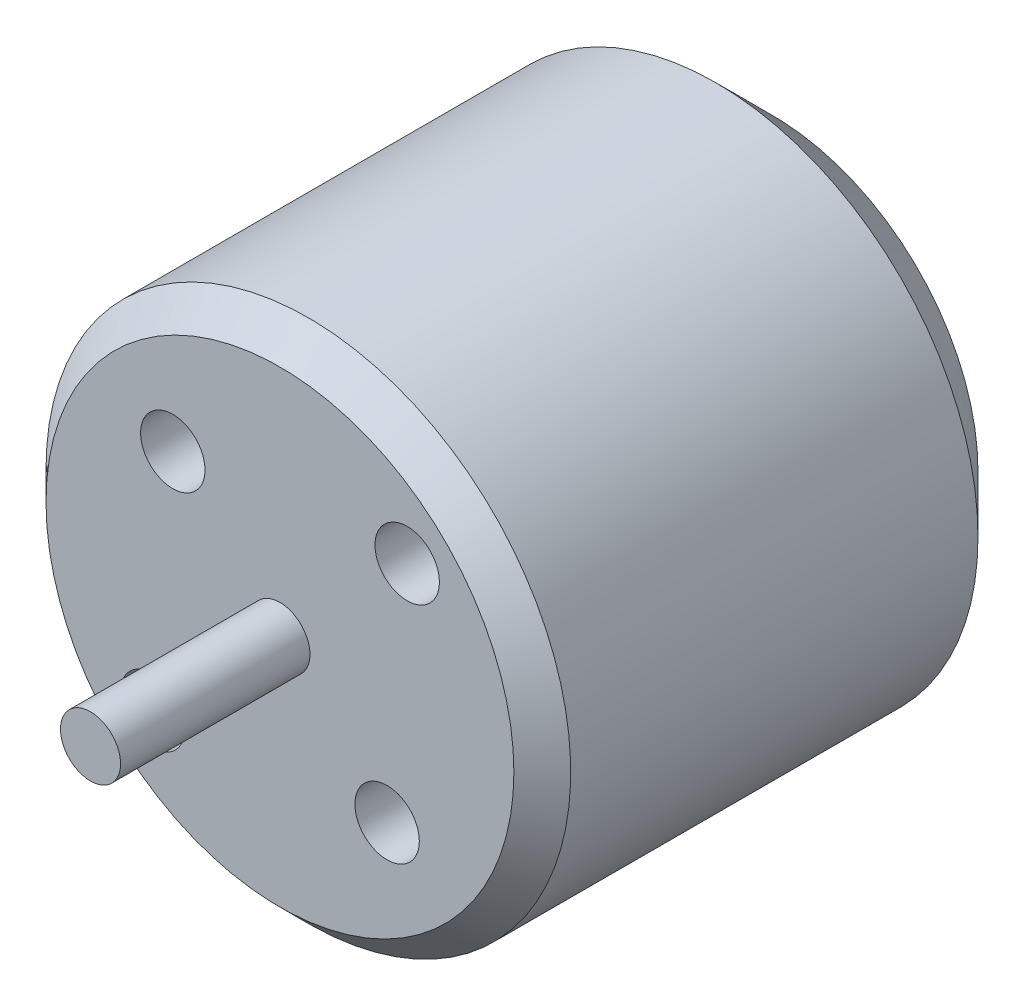
from build123d import *

# Parameters (mm, degrees)
SKETCH1_R                = 13.85
BOSS_EXTRUDE1_DEPTH      = 26
CHAMFER1_SIZE            = 1.5
CHAMFER2_SIZE            = 3
SKETCH2_R                = 4.5
BOSS_EXTRUDE2_DEPTH      = 4
SKETCH3_R                = 1.585
BOSS_EXTRUDE3_DEPTH      = 10
M3_CLEARANCE_HOLE1_D     = 3.4
M3_CLEARANCE_HOLE1_DEPTH = 10
M3_CLEARANCE_HOLE1_TIP   = 1.021463052
M2_CLEARANCE_HOLE1_D     = 2.4
M2_CLEARANCE_HOLE1_DEPTH = 10
M2_CLEARANCE_HOLE1_TIP   = 0.721032743


with BuildPart() as part:
    # Sketch1 → Boss-Extrude1 (new body)
    with BuildSketch(Plane.XY):
        with Locations(Location((0, 0, 0), (0, 0, 180))):
            Circle(SKETCH1_R)
    extrude(amount=BOSS_EXTRUDE1_DEPTH)

    # Chamfer1
    chamfer1_edges = [part.edges().sort_by_distance(p)[0] for p in [
        (13.85, 0, 26),
    ]]
    chamfer(chamfer1_edges, length=CHAMFER1_SIZE)

    # Chamfer2
    chamfer2_edges = [part.edges().sort_by_distance(p)[0] for p in [
        (13.85, 0, 0),
    ]]
    chamfer(chamfer2_edges, length=CHAMFER2_SIZE)

    # Sketch2 → Boss-Extrude2 (add)
    with BuildSketch(Plane(origin=(0, 0, 0), x_dir=(-1, 0, 0), z_dir=(0, 0, -1))):
        Circle(SKETCH2_R)
    extrude(amount=BOSS_EXTRUDE2_DEPTH)

    # Sketch3 → Boss-Extrude3 (add)
    with BuildSketch(Plane.XY.offset(26)):
        Circle(SKETCH3_R)
    extrude(amount=BOSS_EXTRUDE3_DEPTH)

    # M3 Clearance Hole1
    with Locations(Plane.XY.offset(26)):
        with Locations((-5.656854249, 5.656854249), (6.717514421, 6.717514421), (5.656854249, -5.656854249), (-6.717514421, -6.717514421)):
            Hole(M3_CLEARANCE_HOLE1_D / 2, depth=M3_CLEARANCE_HOLE1_DEPTH)
            with Locations((0, 0, -(M3_CLEARANCE_HOLE1_DEPTH + M3_CLEARANCE_HOLE1_TIP / 2))):  # 118° drill point
                Cone(0, M3_CLEARANCE_HOLE1_D / 2, M3_CLEARANCE_HOLE1_TIP, mode=Mode.SUBTRACT)

    # M2 Clearance Hole1
    with Locations(Plane(origin=(0, 0, 0), x_dir=(-1, 0, 0), z_dir=(0, 0, -1))):
        with Locations((0, 6), (5.196152423, -3), (-5.196152423, -3)):
            Hole(M2_CLEARANCE_HOLE1_D / 2, depth=M2_CLEARANCE_HOLE1_DEPTH)
            with Locations((0, 0, -(M2_CLEARANCE_HOLE1_DEPTH + M2_CLEARANCE_HOLE1_TIP / 2))):  # 118° drill point
                Cone(0, M2_CLEARANCE_HOLE1_D / 2, M2_CLEARANCE_HOLE1_TIP, mode=Mode.SUBTRACT)


solid = part.part
